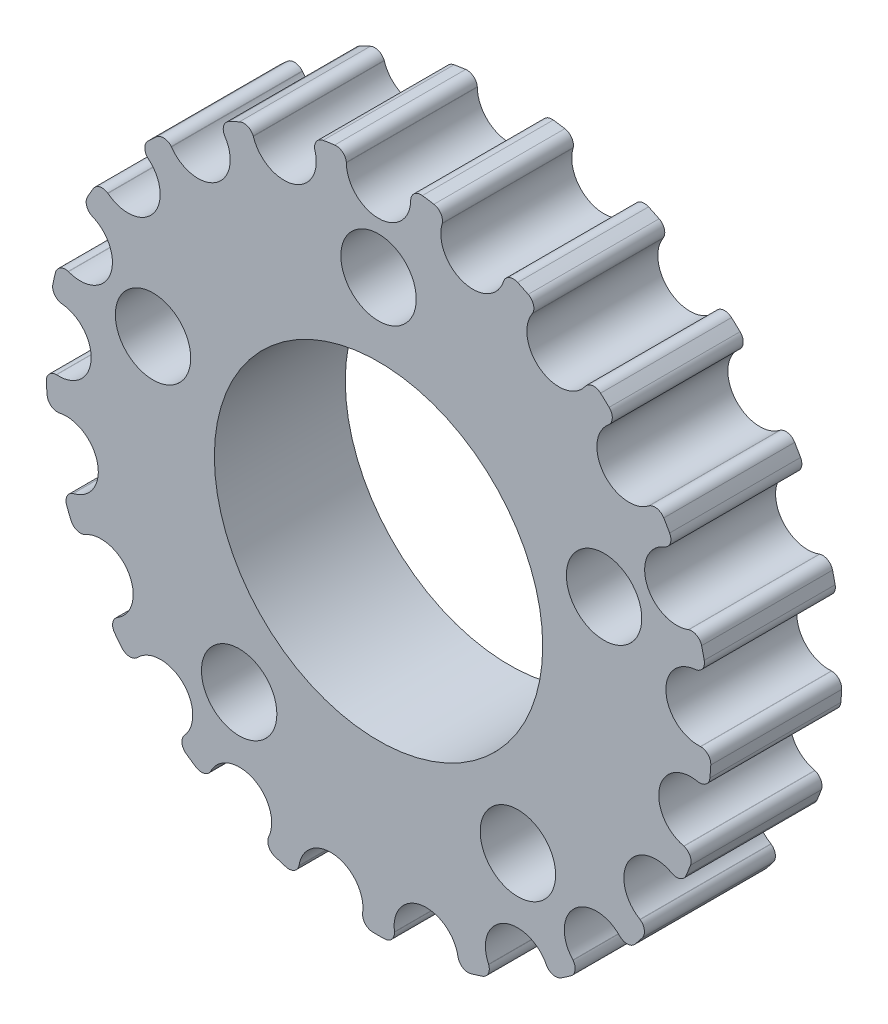
from build123d import *

# Parameters (mm, degrees)
SKETCH2_R                = 16.139769025
BOSS_EXTRUDE1_DEPTH      = 6.35
CUT_EXTRUDE1_DEPTH       = 24.691913986
FILLET1_R                = 0.5
CIRPATTERN1_COUNT        = 21
FILLET1_OF_CIRPATTERN1_R = 0.5
SKETCH4_R                = 7.9629
CUT_EXTRUDE2_DEPTH       = 24.674479536
F_6_CLEARANCE_HOLE1_D    = 3.6576
CIRPATTERN2_COUNT        = 5


with BuildPart() as part:
    # Sketch2 → Boss-Extrude1 (new body)
    with BuildSketch(Plane.XY):
        Circle(SKETCH2_R)
    extrude(amount=BOSS_EXTRUDE1_DEPTH)

    # Sketch3 → Cut-Extrude1 (cut, through all)
    with BuildSketch(Plane(origin=(0, 0, 0), x_dir=(-1, 0, 0), z_dir=(0, 0, -1))):
        with BuildLine():
            Line((-1.612129665, 16.059052964), (-1.56, 15.539769025))
            ThreePointArc((-1.56, 15.539769025), (0, 13.979769025), (1.56, 15.539769025))
            Line((1.56, 15.539769025), (1.612129665, 16.059052964))
            ThreePointArc((1.612129665, 16.059052964), (0, 16.139769025), (-1.612129665, 16.059052964))
        make_face()
    cut_extrude1 = extrude(amount=-CUT_EXTRUDE1_DEPTH, mode=Mode.SUBTRACT)

    # Fillet1
    fillet1_edges = [part.edges().sort_by_distance(p)[0] for p in [
        (1.612129665, 16.059052964, 3.175),
        (-1.612129665, 16.059052964, 3.175),
    ]]
    fillet(fillet1_edges, radius=FILLET1_R)

    # CirPattern1: Cut-Extrude1 ×21 about axis
    cirpattern1_axis = Axis((0, 0, 0), (0, 0, 1))
    for i in range(1, CIRPATTERN1_COUNT):
        add(cut_extrude1.rotate(cirpattern1_axis, i * 360 / CIRPATTERN1_COUNT), mode=Mode.SUBTRACT)

    # Fillet1 of CirPattern1
    fillet1_of_cirpattern1_edges = [part.edges().sort_by_distance(p)[0] for p in [
        (-3.192981691, 15.82077786, 3.175),
        (-6.273996224, 14.870410739, 3.175),
        (-7.71438261, 14.176757214, 3.175),
        (-10.378390686, 12.360467262, 3.175),
        (-11.550326781, 11.273069476, 3.175),
        (-13.560619591, 8.752242025, 3.175),
        (-14.35997373, 7.367720044, 3.175),
        (-15.537927936, 4.366341676, 3.175),
        (-15.893673995, 2.807716354, 3.175),
        (-16.134623196, -0.407527292, 3.175),
        (-16.015151577, -2.001765256, 3.175),
        (-15.29768638, -5.145185672, 3.175),
        (-14.71361266, -6.633381239, 3.175),
        (-13.101482996, -9.425671726, 3.175),
        (-12.104704689, -10.675592188, 3.175),
        (-9.741155353, -12.868645483, 3.175),
        (-8.420240586, -13.769229922, 3.175),
        (-5.515283308, -15.168183616, 3.175),
        (-3.987601155, -15.639411153, 3.175),
        (-0.799354138, -16.11996207, 3.175),
        (0.799354138, -16.11996207, 3.175),
        (3.987601155, -15.639411153, 3.175),
        (5.515283308, -15.168183616, 3.175),
        (8.420240586, -13.769229922, 3.175),
        (9.741155353, -12.868645483, 3.175),
        (12.104704689, -10.675592188, 3.175),
        (13.101482996, -9.425671726, 3.175),
        (14.71361266, -6.633381239, 3.175),
        (15.29768638, -5.145185672, 3.175),
        (16.015151577, -2.001765256, 3.175),
        (16.134623196, -0.407527292, 3.175),
        (15.893673995, 2.807716354, 3.175),
        (15.537927936, 4.366341676, 3.175),
        (14.35997373, 7.367720044, 3.175),
        (13.560619591, 8.752242025, 3.175),
        (11.550326781, 11.273069476, 3.175),
        (10.378390686, 12.360467262, 3.175),
        (7.71438261, 14.176757214, 3.175),
        (6.273996224, 14.870410739, 3.175),
        (3.192981691, 15.82077786, 3.175),
    ]]
    fillet(fillet1_of_cirpattern1_edges, radius=FILLET1_OF_CIRPATTERN1_R)

    # Sketch4 → Cut-Extrude2 (cut, through all)
    with BuildSketch(Plane.XY.offset(6.35)):
        Circle(SKETCH4_R)
    extrude(amount=-CUT_EXTRUDE2_DEPTH, mode=Mode.SUBTRACT)

    # #6 Clearance Hole1 (through all)
    with Locations(Plane.XY.offset(6.35)):
        with Locations((0, 11.5)):
            f_6_clearance_hole1 = Hole(F_6_CLEARANCE_HOLE1_D / 2)

    # CirPattern2: #6 Clearance Hole1 ×5 about axis
    cirpattern2_axis = Axis((0, 0, 0), (0, 0, 1))
    for i in range(1, CIRPATTERN2_COUNT):
        add(f_6_clearance_hole1.rotate(cirpattern2_axis, i * 360 / CIRPATTERN2_COUNT), mode=Mode.SUBTRACT)


solid = part.part
